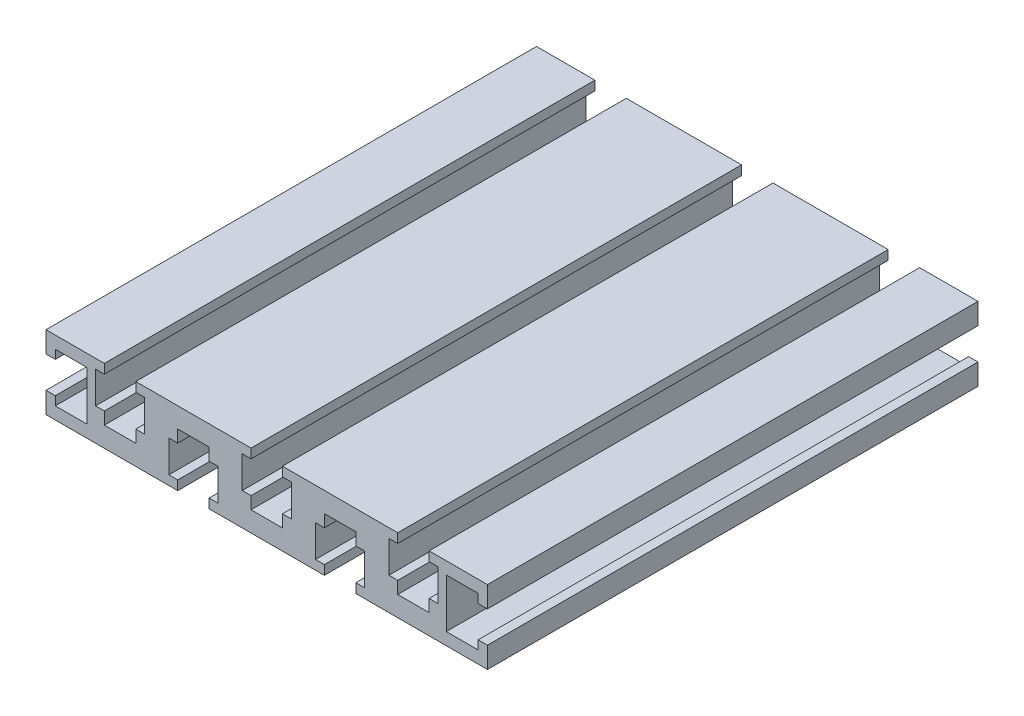
from build123d import *

# Parameters (mm, degrees)
EXTRUDE_1_DEPTH = 100


with BuildPart() as part:
    # 草图1 → 凸台-拉伸1 (new body)
    with BuildSketch(Plane.XY):
        Polygon((-44.574392903, -2.745792426), (-44.574392903, -7.045792426), (-17.724392903, -7.045792426), (-17.724392903, -5.145792426), (-19.524392903, -5.145792426), (-19.524392903, 1.354207574), (-17.724392903, 1.354207574), (-17.724392903, 3.854207574), (-11.324392903, 3.854207574), (-11.324392903, 1.354207574), (-9.524392903, 1.354207574), (-9.524392903, -5.145792426), (-11.324392903, -5.145792426), (-11.324392903, -7.045792426), (12.175607097, -7.045792426), (12.175607097, -5.145792426), (10.375607097, -5.145792426), (10.375607097, 1.354207574), (12.175607097, 1.354207574), (12.175607097, 3.854207574), (18.575607097, 3.854207574), (18.575607097, 1.354207574), (20.375607097, 1.354207574), (20.375607097, -5.145792426), (18.575607097, -5.145792426), (18.575607097, -7.045792426), (45.425607097, -7.045792426), (45.425607097, -2.745792426), (43.525607097, -2.745792426), (43.525607097, -4.545792426), (37.025607097, -4.545792426), (37.025607097, 5.454207574), (43.525607097, 5.454207574), (43.525607097, 3.654207574), (45.425607097, 3.654207574), (45.425607097, 7.954207574), (33.525607097, 7.954207574), (33.525607097, 6.054207574), (35.325607097, 6.054207574), (35.325607097, -0.445792426), (33.525607097, -0.445792426), (33.525607097, -2.945792426), (27.125607097, -2.945792426), (27.125607097, -0.445792426), (25.325607097, -0.445792426), (25.325607097, 6.054207574), (27.125607097, 6.054207574), (27.125607097, 7.954207574), (3.625607097, 7.954207574), (3.625607097, 6.054207574), (5.425607097, 6.054207574), (5.425607097, -0.445792426), (3.625607097, -0.445792426), (3.625607097, -2.945792426), (-2.774392903, -2.945792426), (-2.774392903, -0.445792426), (-4.574392903, -0.445792426), (-4.574392903, 6.054207574), (-2.774392903, 6.054207574), (-2.774392903, 7.954207574), (-26.274392903, 7.954207574), (-26.274392903, 6.054207574), (-24.474392903, 6.054207574), (-24.474392903, -0.445792426), (-26.274392903, -0.445792426), (-26.274392903, -2.945792426), (-32.674392903, -2.945792426), (-32.674392903, -0.445792426), (-34.474392903, -0.445792426), (-34.474392903, 6.054207574), (-32.674392903, 6.054207574), (-32.674392903, 7.954207574), (-44.574392903, 7.954207574), (-44.574392903, 3.654207574), (-42.674392903, 3.654207574), (-42.674392903, 5.454207574), (-36.174392903, 5.454207574), (-36.174392903, -4.545792426), (-42.674392903, -4.545792426), (-42.674392903, -2.745792426), align=None)
    extrude(amount=EXTRUDE_1_DEPTH)


solid = part.part
